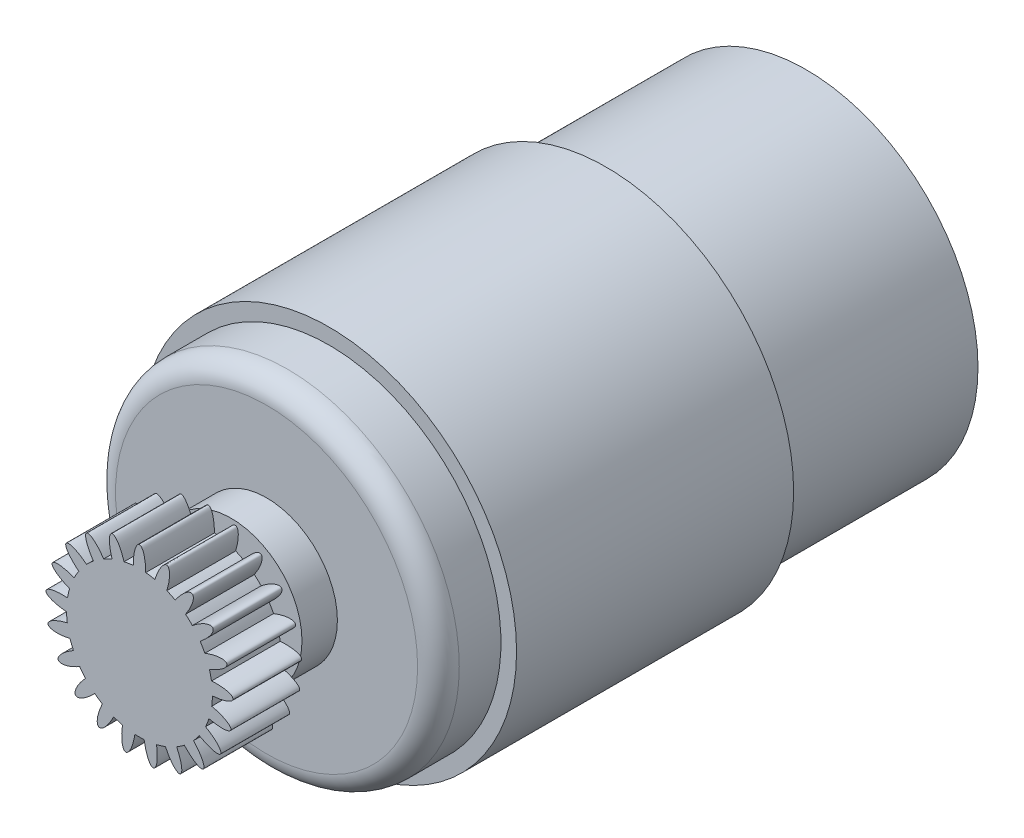
from build123d import *

# Parameters (mm, degrees)
SKETCH1_R           = 22.86
BOSS_EXTRUDE1_DEPTH = 16.891
SKETCH2_R           = 20.955
BOSS_EXTRUDE2_DEPTH = 24.384
BOSS_EXTRUDE3_START = 7.62
SKETCH3_R           = 20.955
BOSS_EXTRUDE3_DEPTH = 7.62
SKETCH4_R           = 8.636
BOSS_EXTRUDE4_DEPTH = 4.318
FILLET1_R           = 2.54
SKETCH5_R           = 3.175
BOSS_EXTRUDE6_DEPTH = 11.176
SKETCH6_R           = 8.89
BOSS_EXTRUDE7_DEPTH = 8.382
SKETCH7_RX          = 2.54
SKETCH7_RY          = 0.762
BOSS_EXTRUDE8_DEPTH = 8.382
CIRPATTERN1_COUNT   = 21


with BuildPart() as part:
    # Sketch1 → Boss-Extrude1 (new, symmetric)
    with BuildSketch(Plane.XY):
        Circle(SKETCH1_R)
    extrude(amount=BOSS_EXTRUDE1_DEPTH, both=True)

    # Sketch2 → Boss-Extrude2 (add)
    with BuildSketch(Plane(origin=(0, 0, -16.891), x_dir=(-1, 0, 0), z_dir=(0, 0, -1))):
        with Locations(Location((0, 0, 0), (0, 0, 180))):
            Circle(SKETCH2_R)
    extrude(amount=BOSS_EXTRUDE2_DEPTH)

    # Sketch3 → Boss-Extrude3 (add)
    with BuildSketch(Plane.XY.offset(16.891).offset(BOSS_EXTRUDE3_START)):
        Circle(SKETCH3_R)
    extrude(amount=-BOSS_EXTRUDE3_DEPTH)

    # Sketch4 → Boss-Extrude4 (add)
    with BuildSketch(Plane.XY.offset(24.511)):
        Circle(SKETCH4_R)
    extrude(amount=BOSS_EXTRUDE4_DEPTH)

    # Fillet1
    fillet1_edges = [part.edges().sort_by_distance(p)[0] for p in [
        (-20.955, 0, 24.511),
    ]]
    fillet(fillet1_edges, radius=FILLET1_R)

    # Sketch5 → Boss-Extrude6 (add)
    with BuildSketch(Plane.XY.offset(28.829)):
        Circle(SKETCH5_R)
    extrude(amount=BOSS_EXTRUDE6_DEPTH)

    # Sketch6 → Boss-Extrude7 (add)
    with BuildSketch(Plane.XY.offset(40.005)):
        Circle(SKETCH6_R)
    extrude(amount=-BOSS_EXTRUDE7_DEPTH)

    # Sketch7 → Boss-Extrude8 (add)
    with BuildSketch(Plane.XY.offset(40.005)):
        with Locations(Location((0, 8.89), (0, 0, 90))):
            Ellipse(SKETCH7_RX, SKETCH7_RY)
    boss_extrude8 = extrude(amount=-BOSS_EXTRUDE8_DEPTH)

    # CirPattern1: Boss-Extrude8 ×21 about axis
    cirpattern1_axis = Axis((0, 0, 44.069), (0, 0, -1))
    for i in range(1, CIRPATTERN1_COUNT):
        add(boss_extrude8.rotate(cirpattern1_axis, i * 360 / CIRPATTERN1_COUNT))


solid = part.part
